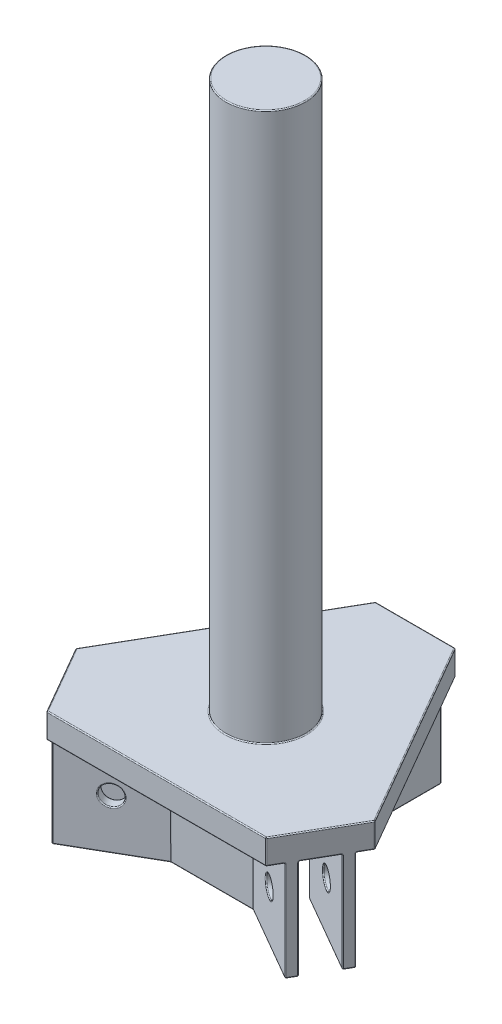
from build123d import *

# Parameters (mm, degrees)
BOSS_EXTRUDE1_DEPTH = 2.5
BOSS_EXTRUDE2_DEPTH = 10
SKETCH3_R           = 4
BOSS_EXTRUDE3_DEPTH = 55
SKETCH4_R           = 1.0000000000000013
CUT_EXTRUDE1_DEPTH  = 63.20886860676198
CIRPATTERN1_COUNT   = 3
FILLET1_R           = 0.1


with BuildPart() as part:
    # Sketch1 → Boss-Extrude1 (new body)
    with BuildSketch(Plane(origin=(0, 0, 0), x_dir=(1, 0, 0), z_dir=(0, 1, 0))):
        Polygon((-4, 15.01110699893029), (4, 15.01110699893029), (14.999999999999984, -4.041451884327455), (10.99999999999995, -10.969655114602947), (-11.000000000000048, -10.969655114602867), (-15.000000000000032, -4.041451884327347), align=None)
    extrude(amount=BOSS_EXTRUDE1_DEPTH)

    # Sketch2 → Boss-Extrude2 (add)
    with BuildSketch(Plane.XZ):
        Polygon((-12.200000000000044, 8.89119414552021), (-4.405771365940083, 4.391194145520235), (4.405771365940083, 4.391194145520235), (12.199999999999983, 8.891194145520261), (11.700000000000008, 9.757219549304661), (4.137822173508961, 5.391194145520235), (-4.137822173509016, 5.391194145520235), (-11.700000000000044, 9.757219549304649), align=None)
        Polygon((2.6000000000011725, -15.011106998930753), (1.6000000000011736, -15.011106998930762), (1.6000000000011279, -6.011106998930788), (6.005771365941208, 1.6199128534095681), (13.800000000001145, 6.119912853409596), (14.300000000001143, 5.253887449625159), (6.737822173510086, 0.8878620458406931), (2.6000000000011267, -6.279056191361911), align=None)
        Polygon((-14.299999999999866, 5.253887449624325), (-13.799999999999871, 6.119912853408764), (-6.005771365939921, 1.619912853408821), (-1.599999999999836, -6.011106998931533), (-1.5999999999998036, -15.011106998931536), (-2.5999999999998042, -15.011106998931538), (-2.5999999999998344, -6.279056191362657), (-6.7378221735088, 0.8878620458399439), align=None)
    extrude(amount=BOSS_EXTRUDE2_DEPTH)

    # Sketch3 → Boss-Extrude3 (add)
    with BuildSketch(Plane(origin=(0, 2.5, 0), x_dir=(1, 0, 0), z_dir=(0, 1, 0))):
        with Locations(Location((0, 0, 0), (0, 0, 270))):
            Circle(SKETCH3_R)
    extrude(amount=BOSS_EXTRUDE3_DEPTH)

    # Sketch4 → Cut-Extrude1 (cut, through all)
    with BuildSketch(Plane(origin=(1.2999999999999794, 0, 2.2516660498395047), x_dir=(0.8660254037844386, 0, -0.5000000000000003), z_dir=(0.5000000000000003, 0, 0.8660254037844386))):
        with Locations((-10.645081595145884, -5)):
            Circle(SKETCH4_R)
    cut_extrude1 = extrude(amount=-CUT_EXTRUDE1_DEPTH, mode=Mode.SUBTRACT)

    # CirPattern1: Cut-Extrude1 ×3 about axis
    cirpattern1_axis = Axis((0, 57.5, 0), (0, -1, 0))
    for i in range(1, CIRPATTERN1_COUNT):
        add(cut_extrude1.rotate(cirpattern1_axis, i * 360 / CIRPATTERN1_COUNT), mode=Mode.SUBTRACT)

    # Fillet1
    fillet1_edges = [part.edges().sort_by_distance(p)[0] for p in [
        (1.22e-15, 2.5, -4),
        (1.22e-15, 57.5, -4),
        (-4, 1.25, -15.01110699893029),
        (4, 1.25, -15.01110699893029),
        (14.999999999999984, 1.25, 4.041451884327455),
        (10.99999999999995, 1.25, 10.969655114602947),
        (-11.000000000000048, 1.25, 10.969655114602867),
        (-15.000000000000032, 1.25, 4.041451884327347),
        (-9.284936490538964, -5, 7.208181443628018),
        (-11.384936490539454, -5, 3.57087474773253),
        (-10.884936490539454, -5, 4.4369001515169675),
        (-8.78493649053897, -5, 8.07420684741245),
        (-4.974e-14, 2.5, 10.969655114602908),
        (8.784936490538962, -5, 8.074206847412468),
        (9.28493649053895, -5, 7.208181443628051),
        (10.884936490539433, -5, 4.436900151517003),
        (11.384936490538934, -5, 3.5708747477334293),
        (2.6000000000011494, -5, -11.645081595145886),
        (1.6000000000011512, -5, -11.645081595145886),
        (-1.59999999999982, -5, -11.645081595145884),
        (-2.5999999999999637, -5, -11.645081595145884),
        (12.999999999999968, 2.5, 7.505553499465201),
        (13.000000000000234, 0, 7.505553499464739),
        (9.499999999999993, 2.5, -5.484827557301417),
        (-11.350000000000048, 0, 10.363437331953758),
        (-11.700000000000044, -5, 9.757219549304649),
        (-8.302885682970064, 0, 6.641194145520222),
        (-12.200000000000044, -5, 8.89119414552021),
        (0, 0, 4.391194145520235),
        (0, 2.5, -15.01110699893029),
        (-4.405771365940083, -5, 4.391194145520235),
        (8.302885682970032, 0, 6.641194145520248),
        (4.405771365940083, -5, 4.391194145520235),
        (12.199999999999983, -5, 8.891194145520261),
        (7.918911086754484, 0, 7.574206847412448),
        (11.700000000000008, -5, 9.757219549304661),
        (-2.753e-14, 0, 5.391194145520235),
        (4.137822173508961, -5, 5.391194145520235),
        (-7.91891108675453, 0, 7.574206847412442),
        (-4.137822173509016, -5, 5.391194145520235),
        (-11.950000000000044, -10, 9.32420684741243),
        (-8.302885682970064, -10, 6.641194145520222),
        (0, -10, 4.391194145520235),
        (8.302885682970032, -10, 6.641194145520248),
        (11.949999999999996, -10, 9.324206847412462),
        (7.918911086754484, -10, 7.574206847412448),
        (-2.753e-14, -10, 5.391194145520235),
        (-7.91891108675453, -10, 7.574206847412442),
        (6.8567e-13, 0, -15.01110699893029),
        (14.650000000000237, 0, 4.647669666976118),
        (14.300000000001143, -5, 5.253887449625159),
        (9.902885682971176, 0, 3.869912853409582),
        (13.800000000001145, -5, 6.119912853409596),
        (3.8028856829711684, 0, -2.19559707276061),
        (6.005771365941208, -5, 1.6199128534095681),
        (1.6000000000011507, 0, -10.511106998930774),
        (1.6000000000011279, -5, -6.011106998930788),
        (1.6000000000011736, -5, -15.011106998930762),
        (2.60000000000115, 0, -10.645081595146333),
        (2.6000000000011725, -5, -15.011106998930753),
        (4.668911086755607, 0, -2.695597072760609),
        (2.6000000000011267, -5, -6.279056191361911),
        (10.518911086755615, 0, 3.070874747732926),
        (6.737822173510086, -5, 0.8878620458406931),
        (14.050000000001145, -10, 5.686900151517378),
        (9.902885682971176, -10, 3.869912853409582),
        (3.8028856829711684, -10, -2.19559707276061),
        (1.6000000000011507, -10, -10.511106998930774),
        (2.100000000001173, -10, -15.011106998930757),
        (2.60000000000115, -10, -10.645081595146333),
        (4.668911086755607, -10, -2.695597072760609),
        (10.518911086755615, -10, 3.070874747732926),
        (-9.500000000000016, 2.5, -5.484827557301471),
        (-3.299999999999902, 0, -15.01110699893029),
        (-13.000000000000288, 0, 7.505553499464678),
        (-2.5999999999998042, -5, -15.011106998931538),
        (-1.5999999999998198, 0, -10.511106998931535),
        (-1.5999999999998036, -5, -15.011106998931536),
        (-3.8028856829698787, 0, -2.1955970727613563),
        (-1.599999999999836, -5, -6.011106998931533),
        (-9.902885682969895, 0, 3.8699128534087928),
        (-6.005771365939921, -5, 1.619912853408821),
        (-13.799999999999871, -5, 6.119912853408764),
        (-10.518911086754333, 0, 3.0708747477321348),
        (-14.299999999999866, -5, 5.253887449624325),
        (-4.668911086754317, 0, -2.6955970727613567),
        (-6.7378221735088, -5, 0.8878620458399439),
        (-2.5999999999998193, 0, -10.645081595147097),
        (3.300000000000586, 0, -15.01110699893029),
        (-2.5999999999998344, -5, -6.279056191362657),
        (-2.099999999999804, -10, -15.011106998931538),
        (-1.5999999999998198, -10, -10.511106998931535),
        (-3.8028856829698787, -10, -2.1955970727613563),
        (-9.902885682969895, -10, 3.8699128534087928),
        (-14.04999999999987, -10, 5.686900151516545),
        (-10.518911086754333, -10, 3.0708747477321348),
        (-4.668911086754317, -10, -2.6955970727613567),
        (-2.5999999999998193, -10, -10.645081595147097),
        (9.499999999999993, 0, -5.484827557301417),
        (11.349999999999977, 0, 10.363437331953802),
        (-4.974e-14, 0, 10.969655114602908),
        (-14.65000000000028, 0, 4.647669666976028),
        (-9.500000000000016, 0, -5.484827557301471),
        (-13.000000000000039, 2.5, 7.5055534994651065),
    ]]
    fillet(fillet1_edges, radius=FILLET1_R)


solid = part.part
